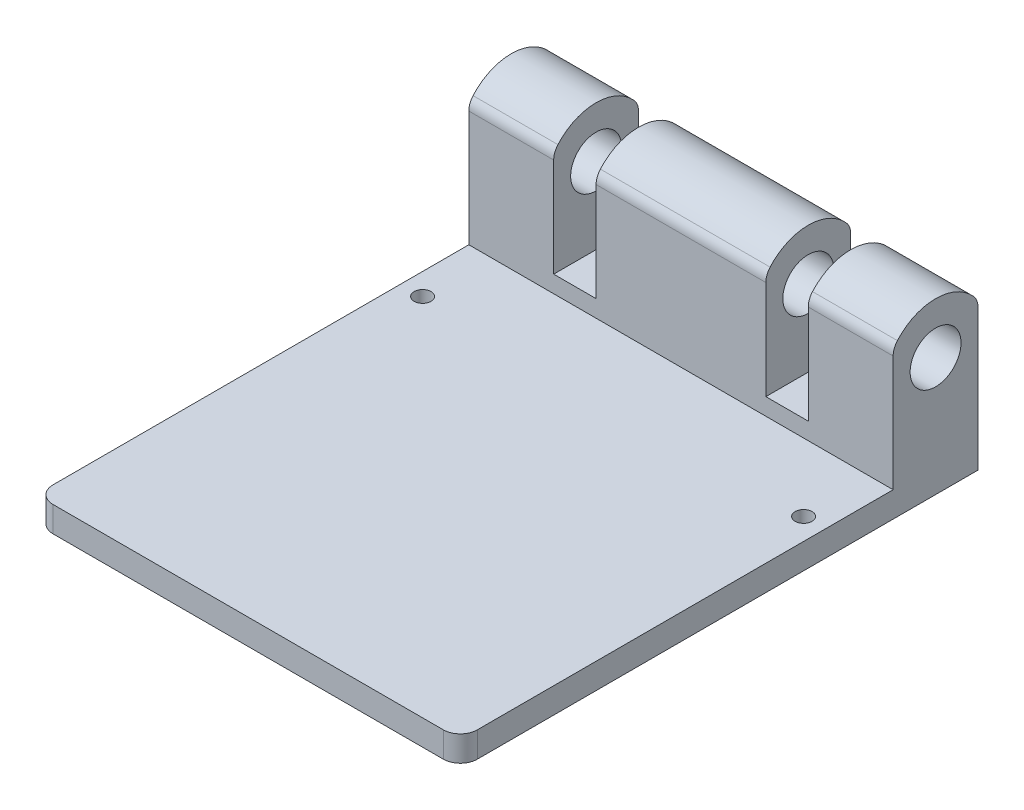
from build123d import *

# Parameters (mm, degrees)
SKETCH1_W           = 50
SKETCH1_H           = 10
BOSS_EXTRUDE1_DEPTH = 20
CUT_EXTRUDE1_DEPTH  = 70
SKETCH3_3_R         = 3
CUT_EXTRUDE2_DEPTH  = 70
SKETCH4_W           = 5
SKETCH4_H           = 15
CUT_EXTRUDE4_DEPTH  = 20
FILLET5_R           = 2
FILLET6_R           = 2
FILLET7_R           = 2
FILLET8_R           = 2
FILLET9_R           = 2
FILLET10_R          = 2
BOSS_EXTRUDE5_DEPTH = 3
SKETCH14_R          = 1
CUT_EXTRUDE5_DEPTH  = 3


with BuildPart() as part:
    # Sketch1 → Boss-Extrude1 (new body)
    with BuildSketch(Plane(origin=(0, 0, 0), x_dir=(1, 0, 0), z_dir=(0, 1, 0))):
        Rectangle(SKETCH1_W, SKETCH1_H)
    extrude(amount=BOSS_EXTRUDE1_DEPTH)

    # Sketch3 → Cut-Extrude1 (cut)
    with BuildSketch(Plane(origin=(25, 0, 0), x_dir=(0, 0, -1), z_dir=(1, 0, 0))):
        with BuildLine():
            ThreePointArc((-5, 17.31662479), (-2.837274331, 19.286764074), (0, 20))
            Line((0, 20), (-5, 20))
            Line((-5, 20), (-5, 17.31662479))
        make_face()
        with BuildLine():
            ThreePointArc((0, 20), (2.837274331, 19.286764074), (5, 17.31662479))
            Line((5, 17.31662479), (5, 20))
            Line((5, 20), (0, 20))
        make_face()
    extrude(amount=-CUT_EXTRUDE1_DEPTH, mode=Mode.SUBTRACT)

    # Sketch3<3> → Cut-Extrude2 (cut)
    with BuildSketch(Plane(origin=(25, 0, 0), x_dir=(0, 0, -1), z_dir=(1, 0, 0))):
        with Locations((0, 14)):
            Circle(SKETCH3_3_R)
    extrude(amount=-CUT_EXTRUDE2_DEPTH, mode=Mode.SUBTRACT)

    # Sketch4 → Cut-Extrude4 (cut)
    with BuildSketch(Plane.XY.offset(5)):
        with Locations((-12.5, 12.5)):
            Rectangle(SKETCH4_W, SKETCH4_H)
        with Locations((12.5, 12.5)):
            Rectangle(SKETCH4_W, SKETCH4_H)
    extrude(amount=-CUT_EXTRUDE4_DEPTH, mode=Mode.SUBTRACT)

    # Fillet5
    fillet5_edges = [part.edges().sort_by_distance(p)[0] for p in [
        (-20, 17.31662479, 5),
    ]]
    fillet(fillet5_edges, radius=FILLET5_R)

    # Fillet6
    fillet6_edges = [part.edges().sort_by_distance(p)[0] for p in [
        (0, 17.31662479, 5),
    ]]
    fillet(fillet6_edges, radius=FILLET6_R)

    # Fillet7
    fillet7_edges = [part.edges().sort_by_distance(p)[0] for p in [
        (20, 17.31662479, 5),
    ]]
    fillet(fillet7_edges, radius=FILLET7_R)

    # Fillet8
    fillet8_edges = [part.edges().sort_by_distance(p)[0] for p in [
        (20, 17.31662479, -5),
    ]]
    fillet(fillet8_edges, radius=FILLET8_R)

    # Fillet9
    fillet9_edges = [part.edges().sort_by_distance(p)[0] for p in [
        (0, 17.31662479, -5),
    ]]
    fillet(fillet9_edges, radius=FILLET9_R)

    # Fillet10
    fillet10_edges = [part.edges().sort_by_distance(p)[0] for p in [
        (-20, 17.31662479, -5),
    ]]
    fillet(fillet10_edges, radius=FILLET10_R)

    # Sketch13 → Boss-Extrude5 (add)
    with BuildSketch(Plane.XZ):
        with BuildLine():
            Line((-25, 5), (25, 5))
            Line((25, 5), (25, 54))
            ThreePointArc((25, 54), (24.414213562, 55.414213562), (23, 56))
            Line((23, 56), (-23, 56))
            ThreePointArc((-23, 56), (-24.414213562, 55.414213562), (-25, 54))
            Line((-25, 54), (-25, 5))
        make_face()
    extrude(amount=-BOSS_EXTRUDE5_DEPTH)

    # Sketch14 → Cut-Extrude5 (cut)
    with BuildSketch(Plane(origin=(0, 3, 0), x_dir=(1, 0, 0), z_dir=(0, 1, 0))):
        with Locations((-22.45, -13)):
            Circle(SKETCH14_R)
        with Locations((22.45, -13)):
            Circle(SKETCH14_R)
    extrude(amount=-CUT_EXTRUDE5_DEPTH, mode=Mode.SUBTRACT)


solid = part.part
